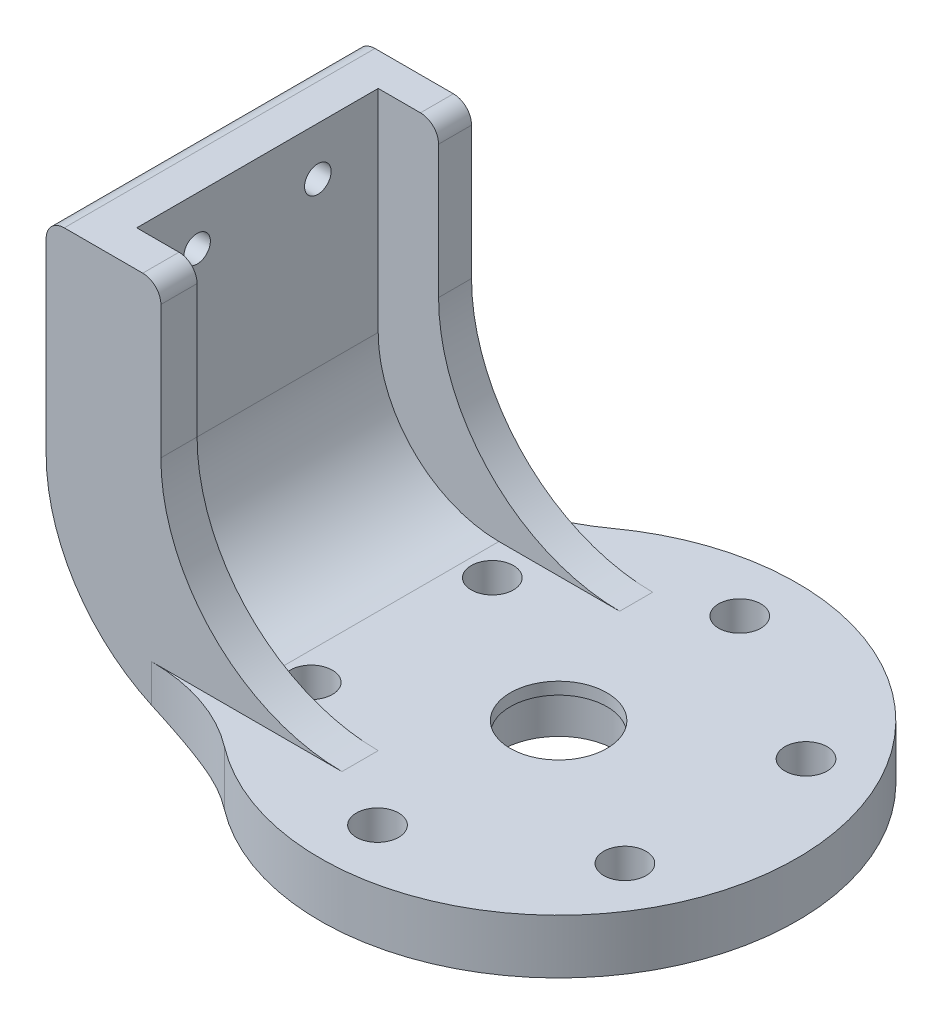
from build123d import *

# Parameters (mm, degrees)
SKETCH1_R           = 9.52
BOSS_EXTRUDE1_DEPTH = 9
BOSS_EXTRUDE2_DEPTH = 55
FILLET1_R           = 30
FILLET2_R           = 20
FILLET3_R           = 30
FILLET8_R           = 3
SKETCH3_R           = 2.2
CUT_EXTRUDE1_DEPTH  = 56
BOSS_EXTRUDE3_START = -2
SKETCH4_R           = 9.52
SKETCH4_R_2         = 8
BOSS_EXTRUDE3_DEPTH = 2
SKETCH5_R           = 3.5
CUT_EXTRUDE2_DEPTH  = 24


with BuildPart() as part:
    # Sketch1 → Boss-Extrude1 (new body)
    with BuildSketch(Plane(origin=(0, 0, 0), x_dir=(1, 0, 0), z_dir=(0, 1, 0))):
        with BuildLine():
            ThreePointArc((21.991235952, -104.520703773), (13.398585056, -99.951074742), (3.795292642, -98.372488761))
            Line((3.795292642, -98.372488761), (-13.679941451, -98.372488761))
            Line((-13.679941451, -98.372488761), (-13.679941451, -46.910148214))
            Line((-13.679941451, -46.910148214), (5.06929783, -46.910148214))
            ThreePointArc((5.06929783, -46.910148214), (14.347129848, -45.439463541), (22.715310843, -41.171603751))
            ThreePointArc((22.715310843, -41.171603751), (85.44664803, -73.567305733), (21.991235952, -104.520703773))
        make_face()
        with Locations(Location((45.949227976, -73.115853541, 0), (0, 0, 270))):
            Circle(SKETCH1_R, mode=Mode.SUBTRACT)
    extrude(amount=BOSS_EXTRUDE1_DEPTH)

    # Sketch2 → Boss-Extrude2 (add)
    with BuildSketch(Plane(origin=(0, 9, 0), x_dir=(1, 0, 0), z_dir=(0, 1, 0))):
        Polygon((-13.679941451, -46.910148214), (-4.679941451, -46.910148214), (5.320058549, -46.910148214), (5.320058549, -52.372488761), (-4.679941451, -52.372488761), (-4.679941451, -92.372488761), (5.320058549, -92.372488761), (5.320058549, -98.372488761), (-4.679941451, -98.372488761), (-13.679941451, -98.372488761), align=None)
    extrude(amount=BOSS_EXTRUDE2_DEPTH)

    # Fillet1
    fillet1_edges = [part.edges().sort_by_distance(p)[0] for p in [
        (5.320058549, 9, 95.372488761),
        (5.320058549, 9, 49.641318487),
    ]]
    fillet(fillet1_edges, radius=FILLET1_R)

    # Fillet2
    fillet2_edges = [part.edges().sort_by_distance(p)[0] for p in [
        (-4.679941451, 9, 72.372488761),
    ]]
    fillet(fillet2_edges, radius=FILLET2_R)

    # Fillet3
    fillet3_edges = [part.edges().sort_by_distance(p)[0] for p in [
        (-13.679941451, 0, 72.641318487),
    ]]
    fillet(fillet3_edges, radius=FILLET3_R)

    # Fillet8
    fillet8_edges = [part.edges().sort_by_distance(p)[0] for p in [
        (-13.679941451, 64, 72.641318487),
        (5.320058549, 64, 95.372488761),
        (5.320058549, 64, 49.641318487),
    ]]
    fillet(fillet8_edges, radius=FILLET8_R)

    # Sketch3 → Cut-Extrude1 (cut)
    with BuildSketch(Plane(origin=(-4.679941451, 0, 0), x_dir=(0, 0, -1), z_dir=(1, 0, 0))):
        with Locations((-62.372488761, 56)):
            Circle(SKETCH3_R)
        with Locations((-82.372488761, 56)):
            Circle(SKETCH3_R)
    extrude(amount=-CUT_EXTRUDE1_DEPTH, mode=Mode.SUBTRACT)

    # Sketch4 → Boss-Extrude3 (add)
    with BuildSketch(Plane(origin=(0, 9, 0), x_dir=(1, 0, 0), z_dir=(0, 1, 0)).offset(BOSS_EXTRUDE3_START)):
        with Locations(Location((45.949227976, -73.115853541, 0), (0, 0, 270))):
            Circle(SKETCH4_R)
        with Locations(Location((45.949227976, -73.115853541, 0), (0, 0, 270))):
            Circle(SKETCH4_R_2, mode=Mode.SUBTRACT)
    extrude(amount=BOSS_EXTRUDE3_DEPTH)

    # Sketch5 → Cut-Extrude2 (cut)
    with BuildSketch(Plane.XZ):
        with Locations(Location((19.968465863, 88.115853541, 0), (0, 0, 270))):
            Circle(SKETCH5_R)
        with Locations(Location((45.949227976, 103.115853541, 0), (0, 0, 270))):
            Circle(SKETCH5_R)
        with Locations(Location((71.92999009, 88.115853541, 0), (0, 0, 270))):
            Circle(SKETCH5_R)
        with Locations(Location((71.92999009, 58.115853541, 0), (0, 0, 270))):
            Circle(SKETCH5_R)
        with Locations(Location((45.949227976, 43.115853541, 0), (0, 0, 270))):
            Circle(SKETCH5_R)
        with Locations(Location((19.968465863, 58.115853541, 0), (0, 0, 270))):
            Circle(SKETCH5_R)
    extrude(amount=-CUT_EXTRUDE2_DEPTH, mode=Mode.SUBTRACT)


solid = part.part
